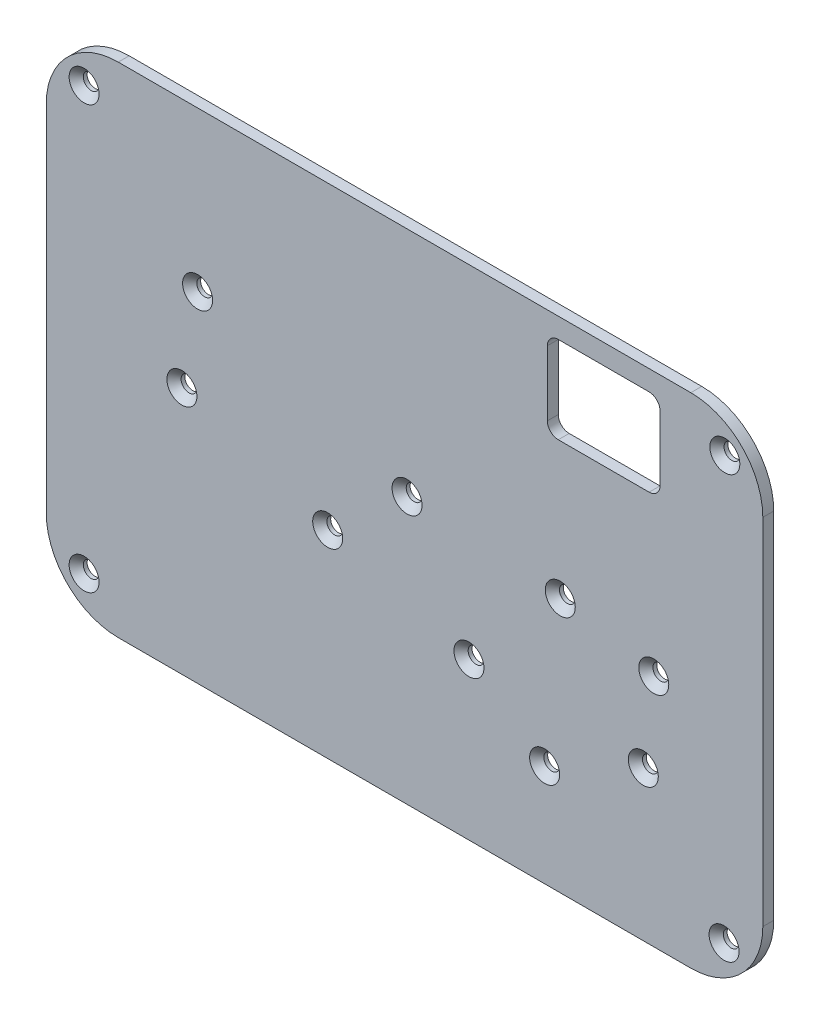
from build123d import *

# Parameters (mm, degrees)
EXTRUDE_1_DEPTH               = 2
HOLE_WIZARD_M2_51_AT_2_COUNT  = 2
HOLE_WIZARD_M2_51_AT_2_PITCH  = 16.931296872
HOLE_WIZARD_M2_51_AT_3_COUNT  = 2
HOLE_WIZARD_M2_51_AT_3_PITCH  = 35.210867013
HOLE_WIZARD_M2_51_AT_4_COUNT  = 2
HOLE_WIZARD_M2_51_AT_4_PITCH  = 59.977461264
HOLE_WIZARD_M2_51_AT_5_COUNT  = 2
HOLE_WIZARD_M2_51_AT_5_PITCH  = 77.079878905
HOLE_WIZARD_M2_51_AT_6_COUNT  = 2
HOLE_WIZARD_M2_51_AT_6_PITCH  = 88.813353391
HOLE_WIZARD_M2_51_AT_7_COUNT  = 2
HOLE_WIZARD_M2_51_AT_7_PITCH  = 85.825277806
HOLE_WIZARD_M2_51_AT_8_COUNT  = 2
HOLE_WIZARD_M2_51_AT_8_PITCH  = 68.275845665
HOLE_WIZARD_M2_51_AT_9_COUNT  = 2
HOLE_WIZARD_M2_51_AT_9_PITCH  = 40.65296425
HOLE_WIZARD_M2_51_AT_10_COUNT = 2
HOLE_WIZARD_M2_51_AT_10_PITCH = 30.544658358
HOLE_WIZARD_M2_51_AT_11_COUNT = 2
HOLE_WIZARD_M2_51_AT_11_PITCH = 58.937345854
HOLE_WIZARD_M2_51_AT_12_COUNT = 2
HOLE_WIZARD_M2_51_AT_12_PITCH = 111.179377124
HOLE_WIZARD_M2_51_AT_13_COUNT = 2
HOLE_WIZARD_M2_51_AT_13_PITCH = 99.231085308
CUT_EXTRUDE_1_DEPTH           = 143.22856359
CUT_EXTRUDE_1_DEPTH_BACK      = 143.22856359


with BuildPart() as part:
    # Outline → Бобышка-Вытянуть1 (new body)
    with BuildSketch(Plane.XY):
        with BuildLine():
            Line((12.02500062, 78.2), (0, 78.2))
            ThreePointArc((0, 78.2), (-9.333809512, 74.333809512), (-13.2, 65))
            Line((-13.2, 65), (-13.2, 0))
            ThreePointArc((-13.2, 0), (-9.333809512, -9.333809512), (0, -13.2))
            Line((0, -13.2), (105, -13.2))
            ThreePointArc((105, -13.2), (114.333809512, -9.333809512), (118.2, 0))
            Line((118.2, 0), (118.2, 65))
            ThreePointArc((118.2, 65), (114.333809512, 74.333809512), (105, 78.2))
            Line((105, 78.2), (12.02500062, 78.2))
        make_face()
    extrude(amount=EXTRUDE_1_DEPTH)

    # Эскиз8 → Отверстие с зазором M2.51 (revolve, cut)
    with BuildSketch(Plane(origin=(14.552676738, 48.9918182, 2), x_dir=(0, -1, 0), z_dir=(1, 0, 0))):
        Polygon((0, 0), (0, 2), (1.45, 2), (1.45, 1.3), (2.75, 0), align=None)
    hole_wizard_m2_51 = revolve(axis=Axis((14.552676738, 48.9918182, 8.35), (0, 0, -1)), mode=Mode.SUBTRACT)

    # Отверстие с зазором M2.51 at 2: Отверстие с зазором M2.51 ×2
    with Locations(*[Vector(-0.17005574614353655, -0.9854344438893767, 0) * (i * HOLE_WIZARD_M2_51_AT_2_PITCH) for i in range(1, HOLE_WIZARD_M2_51_AT_2_COUNT)]):
        add(hole_wizard_m2_51, mode=Mode.SUBTRACT)

    # Отверстие с зазором M2.51 at 3: Отверстие с зазором M2.51 ×2
    with Locations(*[Vector(0.6774960962058836, -0.7355263690893673, 0) * (i * HOLE_WIZARD_M2_51_AT_3_PITCH) for i in range(1, HOLE_WIZARD_M2_51_AT_3_COUNT)]):
        add(hole_wizard_m2_51, mode=Mode.SUBTRACT)

    # Отверстие с зазором M2.51 at 4: Отверстие с зазором M2.51 ×2
    with Locations(*[Vector(0.8296904036666649, -0.5582238207596005, 0) * (i * HOLE_WIZARD_M2_51_AT_4_PITCH) for i in range(1, HOLE_WIZARD_M2_51_AT_4_COUNT)]):
        add(hole_wizard_m2_51, mode=Mode.SUBTRACT)

    # Отверстие с зазором M2.51 at 5: Отверстие с зазором M2.51 ×2
    with Locations(*[Vector(0.8255988861757253, -0.5642574582098157, 0) * (i * HOLE_WIZARD_M2_51_AT_5_PITCH) for i in range(1, HOLE_WIZARD_M2_51_AT_5_COUNT)]):
        add(hole_wizard_m2_51, mode=Mode.SUBTRACT)

    # Отверстие с зазором M2.51 at 6: Отверстие с зазором M2.51 ×2
    with Locations(*[Vector(0.9202423986359286, -0.3913488568436004, 0) * (i * HOLE_WIZARD_M2_51_AT_6_PITCH) for i in range(1, HOLE_WIZARD_M2_51_AT_6_COUNT)]):
        add(hole_wizard_m2_51, mode=Mode.SUBTRACT)

    # Отверстие с зазором M2.51 at 7: Отверстие с зазором M2.51 ×2
    with Locations(*[Vector(0.9746234007113833, -0.22385090302649743, 0) * (i * HOLE_WIZARD_M2_51_AT_7_PITCH) for i in range(1, HOLE_WIZARD_M2_51_AT_7_COUNT)]):
        add(hole_wizard_m2_51, mode=Mode.SUBTRACT)

    # Отверстие с зазором M2.51 at 8: Отверстие с зазором M2.51 ×2
    with Locations(*[Vector(0.9740559678514582, -0.22630725019972095, 0) * (i * HOLE_WIZARD_M2_51_AT_8_PITCH) for i in range(1, HOLE_WIZARD_M2_51_AT_8_COUNT)]):
        add(hole_wizard_m2_51, mode=Mode.SUBTRACT)

    # Отверстие с зазором M2.51 at 9: Отверстие с зазором M2.51 ×2
    with Locations(*[Vector(0.9447489174324829, -0.327794879475186, 0) * (i * HOLE_WIZARD_M2_51_AT_9_PITCH) for i in range(1, HOLE_WIZARD_M2_51_AT_9_COUNT)]):
        add(hole_wizard_m2_51, mode=Mode.SUBTRACT)

    # Отверстие с зазором M2.51 at 10: Отверстие с зазором M2.51 ×2
    with Locations(*[Vector(-0.6814719875063323, 0.73184419806689, 0) * (i * HOLE_WIZARD_M2_51_AT_10_PITCH) for i in range(1, HOLE_WIZARD_M2_51_AT_10_COUNT)]):
        add(hole_wizard_m2_51, mode=Mode.SUBTRACT)

    # Отверстие с зазором M2.51 at 11: Отверстие с зазором M2.51 ×2
    with Locations(*[Vector(-0.35317723825652403, -0.9355564324921798, 0) * (i * HOLE_WIZARD_M2_51_AT_11_PITCH) for i in range(1, HOLE_WIZARD_M2_51_AT_11_COUNT)]):
        add(hole_wizard_m2_51, mode=Mode.SUBTRACT)

    # Отверстие с зазором M2.51 at 12: Отверстие с зазором M2.51 ×2
    with Locations(*[Vector(0.8683521022085285, -0.49594820958445784, 0) * (i * HOLE_WIZARD_M2_51_AT_12_PITCH) for i in range(1, HOLE_WIZARD_M2_51_AT_12_COUNT)]):
        add(hole_wizard_m2_51, mode=Mode.SUBTRACT)

    # Отверстие с зазором M2.51 at 13: Отверстие с зазором M2.51 ×2
    with Locations(*[Vector(0.9742960388993211, 0.2252714553268849, 0) * (i * HOLE_WIZARD_M2_51_AT_13_PITCH) for i in range(1, HOLE_WIZARD_M2_51_AT_13_COUNT)]):
        add(hole_wizard_m2_51, mode=Mode.SUBTRACT)

    # Эскиз10 → Вырез-Вытянуть1 (cut, two sides: drawn at the far end of the back side and taken through both)
    with BuildSketch(Plane.XY.offset(-9.9366788).offset(-CUT_EXTRUDE_1_DEPTH_BACK)):
        with BuildLine():
            Line((80.689492233, 74.5), (97.346654465, 74.5))
            ThreePointArc((97.346654465, 74.5), (98.760868027, 73.914213562), (99.346654465, 72.5))
            Line((99.346654465, 72.5), (99.346654465, 60.572687633))
            ThreePointArc((99.346654465, 60.572687633), (98.760868027, 59.158474071), (97.346654465, 58.572687633))
            Line((97.346654465, 58.572687633), (80.689492233, 58.572687633))
            ThreePointArc((80.689492233, 58.572687633), (79.275278671, 59.158474071), (78.689492233, 60.572687633))
            Line((78.689492233, 60.572687633), (78.689492233, 72.5))
            ThreePointArc((78.689492233, 72.5), (79.275278671, 73.914213562), (80.689492233, 74.5))
        make_face()
    extrude(amount=CUT_EXTRUDE_1_DEPTH + CUT_EXTRUDE_1_DEPTH_BACK, mode=Mode.SUBTRACT)


solid = part.part
